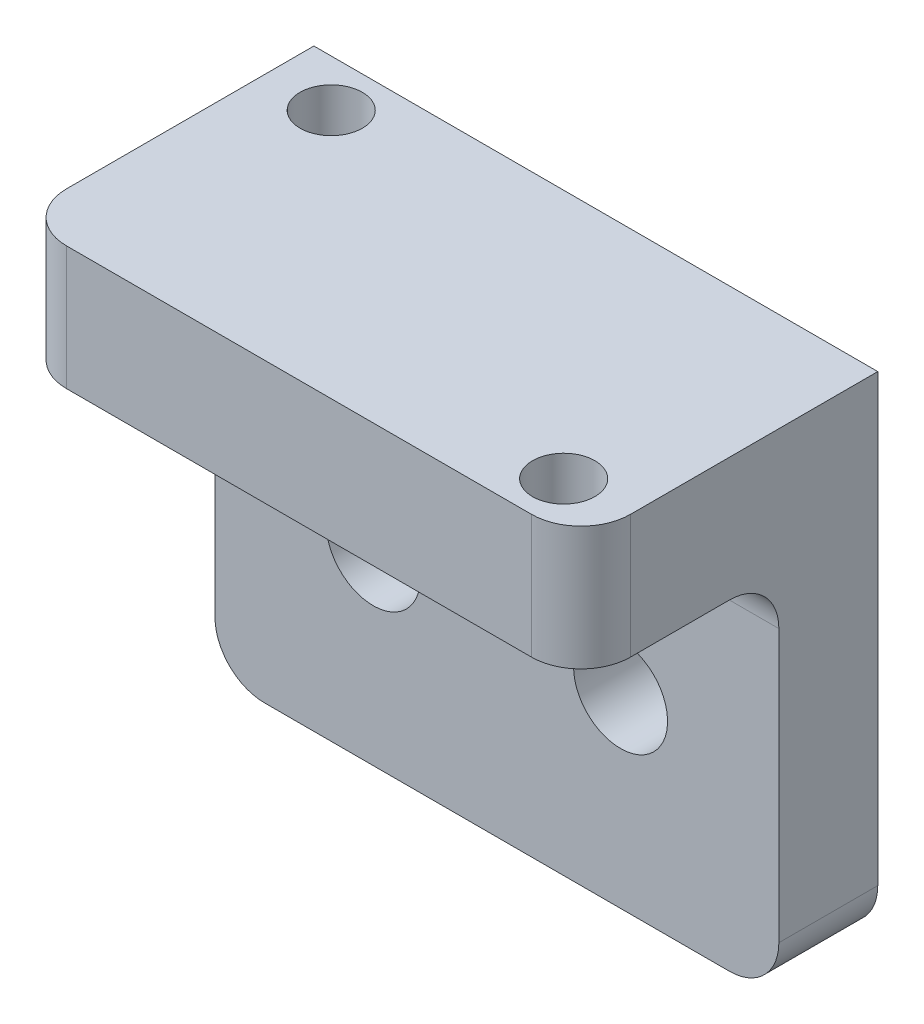
from build123d import *

# Parameters (mm, degrees)
SKETCH1_W           = 28.956
SKETCH1_H           = 15.24
SKETCH1_R           = 1.6002
BOSS_EXTRUDE1_DEPTH = 6.35
SKETCH2_W           = 28.956
SKETCH2_H           = 19.05
SKETCH2_R           = 2.413
BOSS_EXTRUDE2_DEPTH = 5.08
FILLET1_R           = 2.54


with BuildPart() as part:
    # Sketch1 → Boss-Extrude1 (new body)
    with BuildSketch(Plane(origin=(0, 0, 0), x_dir=(1, 0, 0), z_dir=(0, 1, 0))):
        Rectangle(SKETCH1_W, SKETCH1_H)
        with Locations(Location((-11.176, 5.207, 0), (0, 0, 270))):
            Circle(SKETCH1_R, mode=Mode.SUBTRACT)
        with Locations(Location((11.176, -5.207, 0), (0, 0, 270))):
            Circle(SKETCH1_R, mode=Mode.SUBTRACT)
    extrude(amount=-BOSS_EXTRUDE1_DEPTH)

    # Sketch2 → Boss-Extrude2 (add)
    with BuildSketch(Plane(origin=(0, 0, -7.62), x_dir=(-1, 0, 0), z_dir=(0, 0, -1))):
        with Locations((0, -15.875)):
            Rectangle(SKETCH2_W, SKETCH2_H)
        with Locations((-6.35, -15.875)):
            Circle(SKETCH2_R, mode=Mode.SUBTRACT)
        with Locations((6.35, -15.875)):
            Circle(SKETCH2_R, mode=Mode.SUBTRACT)
    extrude(amount=-BOSS_EXTRUDE2_DEPTH)

    # Fillet1
    fillet1_edges = [part.edges().sort_by_distance(p)[0] for p in [
        (0, -6.35, -2.54),
        (14.478, -25.4, -5.08),
        (-14.478, -25.4, -5.08),
        (14.478, -3.175, 7.62),
        (-14.478, -3.175, 7.62),
    ]]
    fillet(fillet1_edges, radius=FILLET1_R)


solid = part.part
